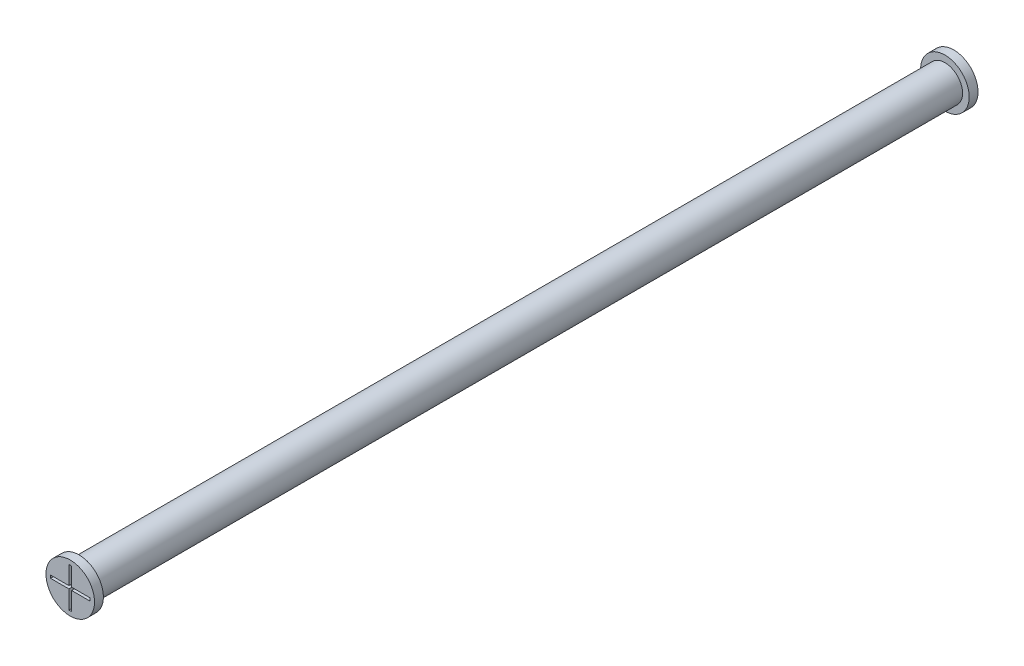
from build123d import *

# Parameters (mm, degrees)
SKETCH1_R           = 2
BOSS_EXTRUDE1_DEPTH = 98
SKETCH2_R           = 2.75
BOSS_EXTRUDE2_DEPTH = 1
BOSS_EXTRUDE3_START = 1
SKETCH3_R           = 2.75
BOSS_EXTRUDE3_DEPTH = 1
CUT_EXTRUDE1_DEPTH  = 0.5
CUT_EXTRUDE2_DEPTH  = 0.5


with BuildPart() as part:
    # Sketch1 → Boss-Extrude1 (new body)
    with BuildSketch(Plane.XY):
        Circle(SKETCH1_R)
    extrude(amount=BOSS_EXTRUDE1_DEPTH)

    # Sketch2 → Boss-Extrude2 (add)
    with BuildSketch(Plane.XY.offset(98)):
        Circle(SKETCH2_R)
    extrude(amount=BOSS_EXTRUDE2_DEPTH)

    # Sketch3 → Boss-Extrude3 (add)
    with BuildSketch(Plane(origin=(0, 0, 0), x_dir=(-1, 0, 0), z_dir=(0, 0, -1)).offset(BOSS_EXTRUDE3_START)):
        with Locations(Location((0, 0, 0), (0, 0, 180))):
            Circle(SKETCH3_R)
    extrude(amount=-BOSS_EXTRUDE3_DEPTH)

    # Sketch4 → Cut-Extrude1 (cut)
    with BuildSketch(Plane(origin=(0, 0, -1), x_dir=(-1, 0, 0), z_dir=(0, 0, -1))):
        Polygon((-0.154926193, -0.160877279), (-0.154926193, -2.234675522), (0.154926193, -2.234675522), (0.154926193, -0.160877279), (2.234675522, -0.160877279), (2.234675522, 0.160877279), (0.154926193, 0.160877279), (0.154926193, 2.234675522), (-0.154926193, 2.234675522), (-0.154926193, 0.160877279), (-2.234675522, 0.160877279), (-2.234675522, -0.160877279), align=None)
    extrude(amount=-CUT_EXTRUDE1_DEPTH, mode=Mode.SUBTRACT)

    # Sketch5 → Cut-Extrude2 (cut)
    with BuildSketch(Plane.XY.offset(99)):
        Polygon((-2.234675522, -0.160877279), (-0.154926193, -0.160877279), (-0.154926193, -2.234675522), (0.154926193, -2.234675522), (0.154926193, -0.160877279), (2.234675522, -0.160877279), (2.234675522, 0.160877279), (0.154926193, 0.160877279), (0.154926193, 2.234675522), (-0.154926193, 2.234675522), (-0.154926193, 0.160877279), (-2.234675522, 0.160877279), align=None)
    extrude(amount=-CUT_EXTRUDE2_DEPTH, mode=Mode.SUBTRACT)


solid = part.part
